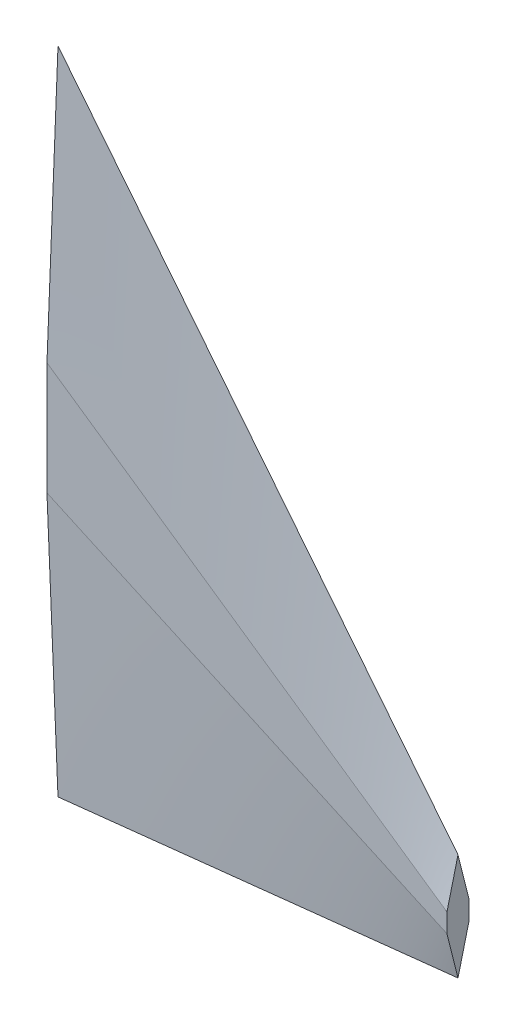
from build123d import *


with BuildPart() as part:
    # Sketch1 → Loft1 section 0
    with BuildSketch(Plane(origin=(0, 0, 0), x_dir=(0, 0, -1), z_dir=(1, 0, 0))):
        with BuildLine():
            Line((0, 74.29), (2.521153846, 12.87))
            Line((2.521153846, 12.87), (2.521153846, -12.87))
            Line((2.521153846, -12.87), (0, -74.29))
            Line((0, -74.29), (-2.521153846, -12.87))
            Line((-2.521153846, -12.87), (-2.521153846, 12.87))
            Line((-2.521153846, 12.87), (0, 74.29))
        make_face()
    # Sketch2 → Loft1 section 1
    with BuildSketch(Plane(origin=(91.39, 0, 0), x_dir=(0, 0, -1), z_dir=(1, 0, 0))):
        with BuildLine():
            Line((0, -64.424), (2.521153846, -54.391))
            Line((2.521153846, -54.391), (2.521153846, -50.073))
            Line((2.521153846, -50.073), (0, -40.04))
            Line((0, -40.04), (-2.521153846, -50.073))
            Line((-2.521153846, -50.073), (-2.521153846, -54.391))
            Line((-2.521153846, -54.391), (0, -64.424))
        make_face()
    loft()


solid = part.part
